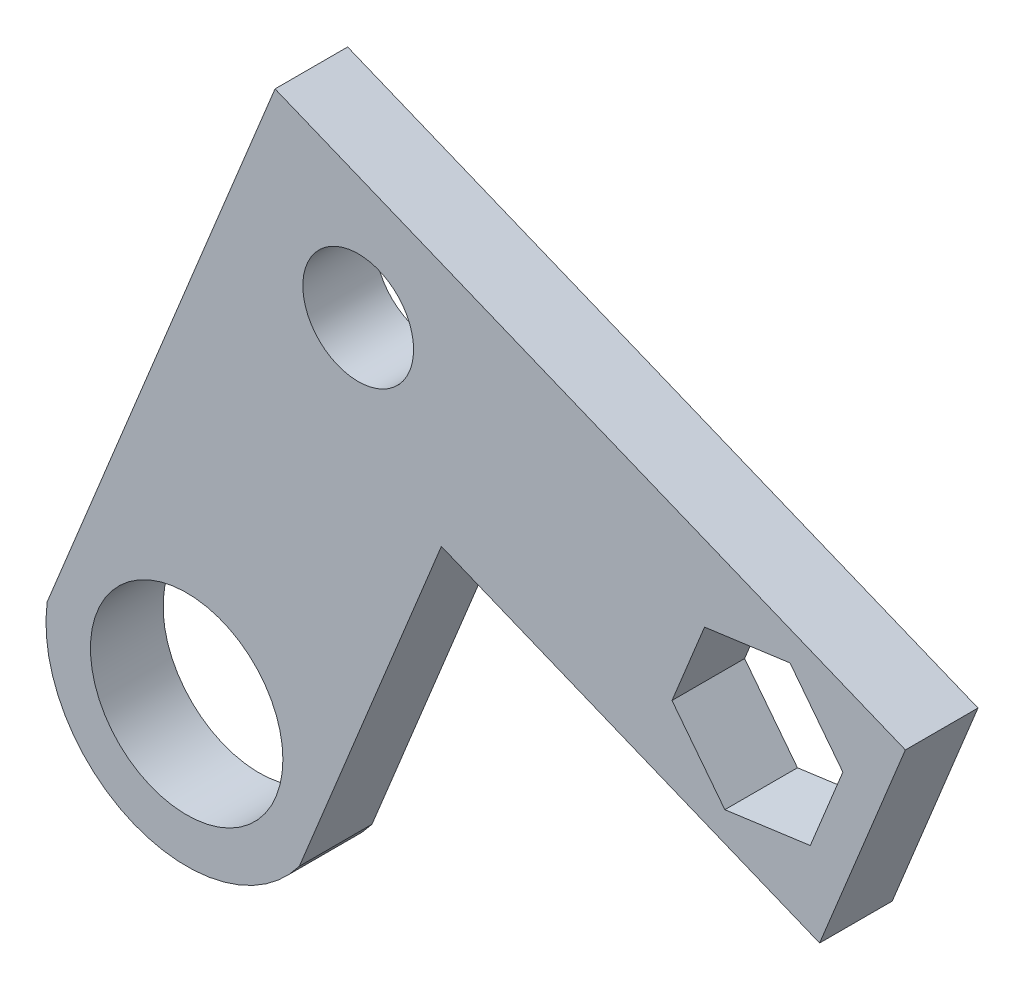
from build123d import *

# Parameters (mm, degrees)
SKETCH_1_R      = 6.1
SKETCH_1_R_2    = 10.6
EXTRUDE_1_DEPTH = 8


with BuildPart() as part:
    # 草圖1 → 填料-伸長1 (new body)
    with BuildSketch(Plane.XY):
        with BuildLine():
            Line((-42.684704159, 14.986968014), (26.753169389, -13.357021069))
            Line((26.753169389, -13.357021069), (17.305173028, -36.502978918))
            Line((17.305173028, -36.502978918), (-24.357551101, -19.496585468))
            Line((-24.357551101, -19.496585468), (-40.005369853, -57.831036438))
            ThreePointArc((-40.005369853, -57.831036438), (-58.274878096, -62.897218292), (-67.780519272, -46.493440805))
            Line((-67.780519272, -46.493440805), (-42.684704159, 14.986968014))
        make_face()
        with Locations((-33.52112763, -2.254808727)):
            Circle(SKETCH_1_R, mode=Mode.SUBTRACT)
        with Locations((-52.417120352, -48.546724426)):
            Circle(SKETCH_1_R_2, mode=Mode.SUBTRACT)
        Polygon((1.043977728, -21.494495956), (4.634216345, -12.699031974), (14.046430901, -11.41053783), (19.868406839, -18.91750767), (16.278168222, -27.712971653), (6.865953666, -29.001465796), align=None, mode=Mode.SUBTRACT)
    extrude(amount=-EXTRUDE_1_DEPTH)


solid = part.part
